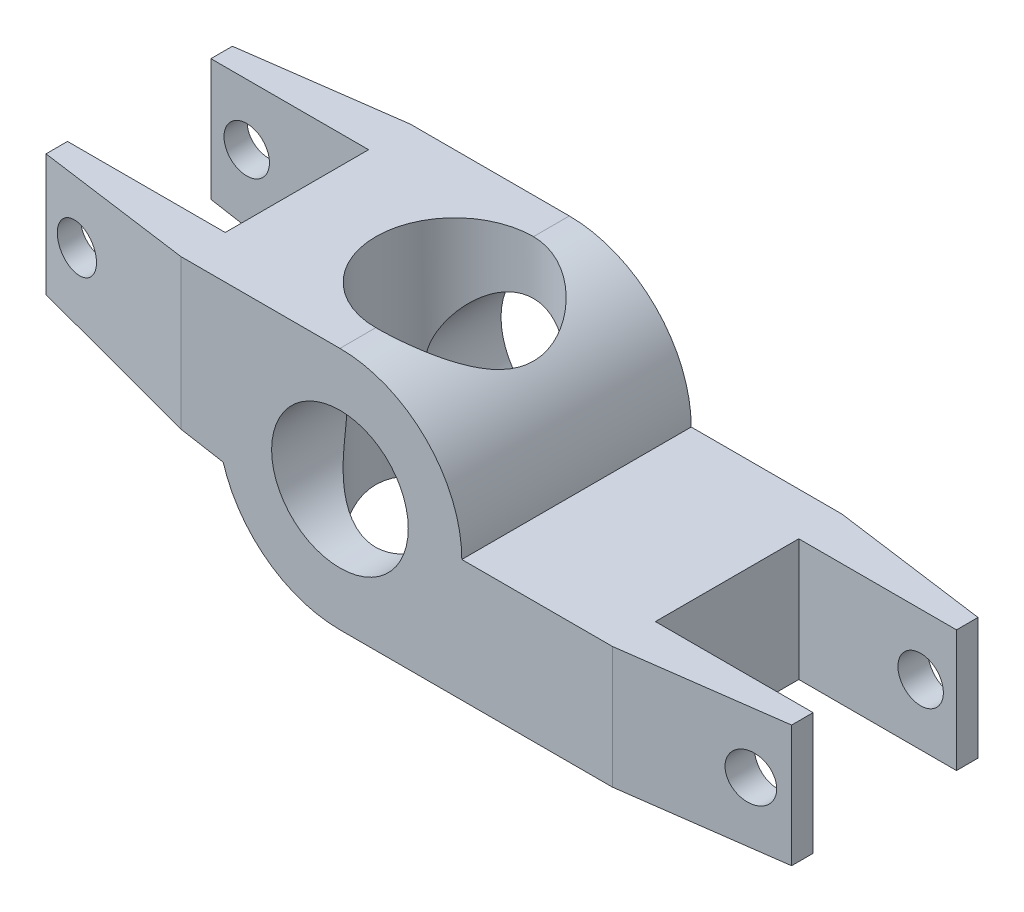
from build123d import *

# Parameters (mm, degrees)
SKETCH1_R           = 8.5
SKETCH1_R_2         = 4.765
BOSS_EXTRUDE1_DEPTH = 8
SKETCH2_R           = 5.5
CUT_EXTRUDE1_DEPTH  = 36.397740041
SKETCH7_W           = 11
SKETCH7_H           = 10
CUT_EXTRUDE3_DEPTH  = 16
SKETCH14_R          = 1.585
CUT_EXTRUDE5_DEPTH  = 22
SKETCH15_W          = 11
SKETCH15_H          = 10
CUT_EXTRUDE6_DEPTH  = 22


with BuildPart() as part:
    # Sketch1 → Boss-Extrude1 (new, symmetric)
    # profile 1 of 3: a face of its own
    with BuildSketch(Plane.XY):
        with BuildLine():
            Line((-22, 0), (-8.141153884, -2.443688492))
            ThreePointArc((-8.141153884, -2.443688492), (-6.819873612, 5.073393727), (0, 8.5))
            Line((0, 8.5), (-22, 8.5))
            Line((-22, 8.5), (-22, 0))
        make_face()
    # profile 2 of 3: a face of its own
    with BuildSketch(Plane.XY):
        Circle(SKETCH1_R)
        Circle(SKETCH1_R_2, mode=Mode.SUBTRACT)
    # profile 3 of 3: a face of its own
    with BuildSketch(Plane.XY):
        with BuildLine():
            ThreePointArc((8.5, 0), (6.01040764, -6.01040764), (0, -8.5))
            Line((0, -8.5), (30, -8.5))
            Line((30, -8.5), (30, 0))
            Line((30, 0), (8.5, 0))
        make_face()
    extrude(amount=BOSS_EXTRUDE1_DEPTH, both=True)

    # Sketch2 → Cut-Extrude1 (cut, through all)
    with BuildSketch(Plane(origin=(0, 8.5, 0), x_dir=(1, 0, 0), z_dir=(0, 1, 0))):
        with Locations(Location((0, 0, 0), (0, 0, 270))):
            Circle(SKETCH2_R)
    extrude(amount=-CUT_EXTRUDE1_DEPTH, mode=Mode.SUBTRACT)

    # Sketch7 → Cut-Extrude3 (cut)
    with BuildSketch(Plane(origin=(0, 8.5, 0), x_dir=(1, 0, 0), z_dir=(0, 1, 0))):
        with Locations((-16.5, 0)):
            Rectangle(SKETCH7_W, SKETCH7_H)
    extrude(amount=-CUT_EXTRUDE3_DEPTH, mode=Mode.SUBTRACT)

    # Sketch13 → Cut-Loft6 section 0
    with BuildSketch(Plane(origin=(0, 8.5, 0), x_dir=(1, 0, 0), z_dir=(0, 1, 0))):
        with BuildLine():
            Line((-22, -6.5), (-22, -8))
            Line((-22, -8), (-11.095577143, -8))
            Line((-11.095577143, -8), (-22, -6.5))
        make_face()
    # Sketch12 → Cut-Loft6 section 1
    with BuildSketch(Plane(origin=(-0.663381171, -3.762221577, 0), x_dir=(0.9848077530122088, -0.17364817766692656, 0), z_dir=(-0.17364817766692653, -0.9848077530122087, 0))):
        with BuildLine():
            Line((-10.59312941, 8), (-21.665770566, 6.5))
            Line((-21.665770566, 6.5), (-21.665770566, 8))
            Line((-21.665770566, 8), (-10.59312941, 8))
        make_face()
    cut_loft6 = loft(mode=Mode.SUBTRACT)

    # Mirror1: Cut-Loft6 across plane
    add(cut_loft6.mirror(Plane.XY), mode=Mode.SUBTRACT)

    # Sketch14 → Cut-Extrude5 (cut, symmetric)
    with BuildSketch(Plane.XY):
        with Locations(Location((-19.5, 4.25, 0), (0, 0, 180))):
            Circle(SKETCH14_R)
        with Locations((27.5, -4.25)):
            Circle(SKETCH14_R)
    extrude(amount=CUT_EXTRUDE5_DEPTH, both=True, mode=Mode.SUBTRACT)

    # Sketch15 → Cut-Extrude6 (cut, symmetric)
    with BuildSketch(Plane(origin=(0, 0, 0), x_dir=(1, 0, 0), z_dir=(0, 1, 0))):
        Polygon((30, 8), (19, 8), (30, 6.5), align=None)
        with Locations((24.5, 0)):
            Rectangle(SKETCH15_W, SKETCH15_H)
        Polygon((30, -6.5), (19, -8), (30, -8), align=None)
    extrude(amount=CUT_EXTRUDE6_DEPTH, both=True, mode=Mode.SUBTRACT)


solid = part.part
